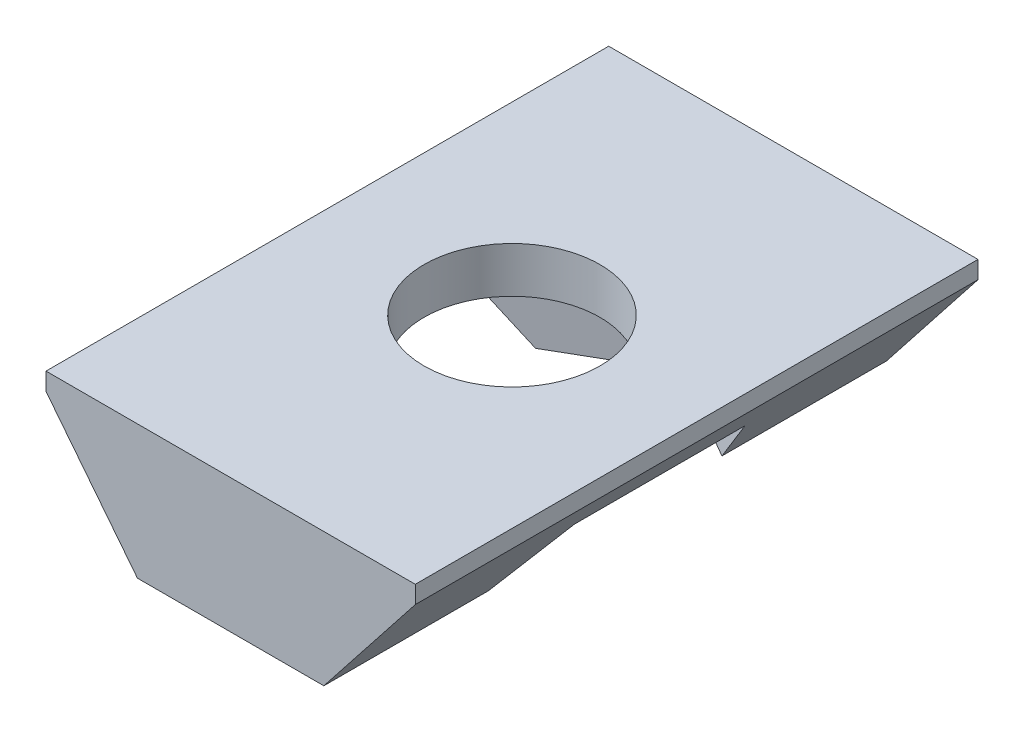
from build123d import *

# Parameters (mm, degrees)
RESSALTO_EXTRUS_O1_DEPTH   = 16
CORTE_EXTRUS_O1_DEPTH      = 18.262748912
CORTE_EXTRUS_O1_DEPTH_BACK = 18.262748912
ESBO_O2_R                  = 2.5
CORTE_EXTRUS_O2_DEPTH      = 2.5


with BuildPart() as part:
    # Esboço1 → Ressalto-extrusão1 (new body)
    with BuildSketch(Plane.XY):
        Polygon((-2.65, 0), (2.65, 0), (5.25, 3.3), (5.25, 3.8), (-5.25, 3.8), (-5.25, 3.3), align=None)
    extrude(amount=RESSALTO_EXTRUS_O1_DEPTH)

    # Esboço2 → Corte-extrusão1 (cut, two sides: drawn at the far end of the back side and taken through both)
    with BuildSketch(Plane(origin=(0, 3.8, 0), x_dir=(1, 0, 0), z_dir=(0, 1, 0)).offset(-CORTE_EXTRUS_O1_DEPTH_BACK)):
        with Locations(Location((0, -8, 0), (0, 0, 270))):
            Circle(ESBO_O2_R)
    extrude(amount=CORTE_EXTRUS_O1_DEPTH + CORTE_EXTRUS_O1_DEPTH_BACK, mode=Mode.SUBTRACT)

    # Esboço3 → Corte-extrusão2 (cut)
    with BuildSketch(Plane.XZ):
        Polygon((0, 12.849742261), (-4.2, 10.424871131), (-4.2, 5.575128869), (0, 3.150257739), (4.2, 5.575128869), (4.2, 10.424871131), align=None)
    extrude(amount=-CORTE_EXTRUS_O2_DEPTH, mode=Mode.SUBTRACT)


solid = part.part
